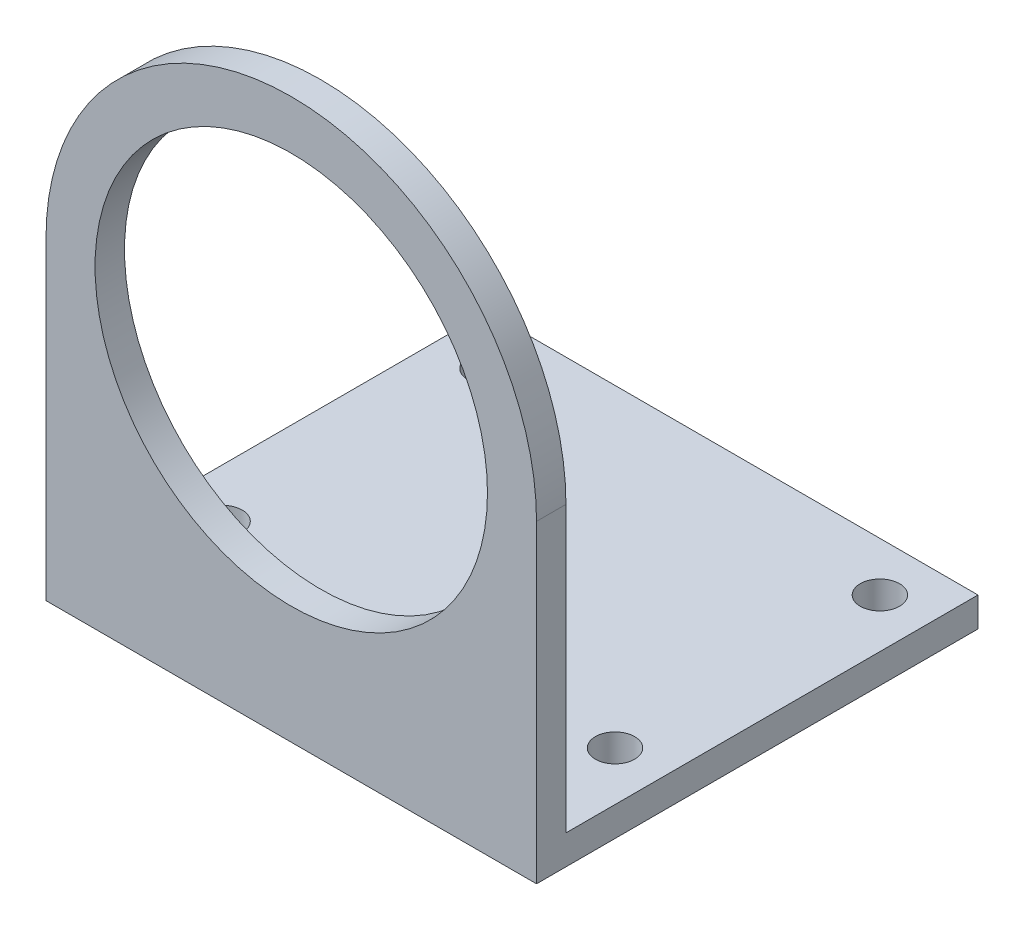
from build123d import *

# Parameters (mm, degrees)
SKETCH1_R           = 20
BOSS_EXTRUDE1_DEPTH = 3
SKETCH2_W           = 50
SKETCH2_H           = 3
BOSS_EXTRUDE2_DEPTH = 45
SKETCH3_R           = 2
CUT_EXTRUDE1_DEPTH  = 73.835430939


with BuildPart() as part:
    # Sketch1 → Boss-Extrude1 (new body)
    with BuildSketch(Plane.XY):
        with BuildLine():
            Line((-25, 0), (25, 0))
            Line((25, 0), (25, 29))
            ThreePointArc((25, 29), (0, 54), (-25, 29))
            Line((-25, 29), (-25, 0))
        make_face()
        with Locations((0, 29)):
            Circle(SKETCH1_R, mode=Mode.SUBTRACT)
    extrude(amount=BOSS_EXTRUDE1_DEPTH)

    # Sketch2 → Boss-Extrude2 (add)
    with BuildSketch(Plane.XY.offset(3)):
        with Locations((0, -1.5)):
            Rectangle(SKETCH2_W, SKETCH2_H)
    extrude(amount=-BOSS_EXTRUDE2_DEPTH)

    # Sketch3 → Cut-Extrude1 (cut, through all)
    with BuildSketch(Plane(origin=(0, 0, 0), x_dir=(1, 0, 0), z_dir=(0, 1, 0))):
        with Locations(Location((-20, 37, 0), (0, 0, 180))):
            Circle(SKETCH3_R)
        with Locations(Location((-20, 10, 0), (0, 0, 180))):
            Circle(SKETCH3_R)
        with Locations((20, 10)):
            Circle(SKETCH3_R)
        with Locations((20, 37)):
            Circle(SKETCH3_R)
    extrude(amount=-CUT_EXTRUDE1_DEPTH, mode=Mode.SUBTRACT)


solid = part.part
